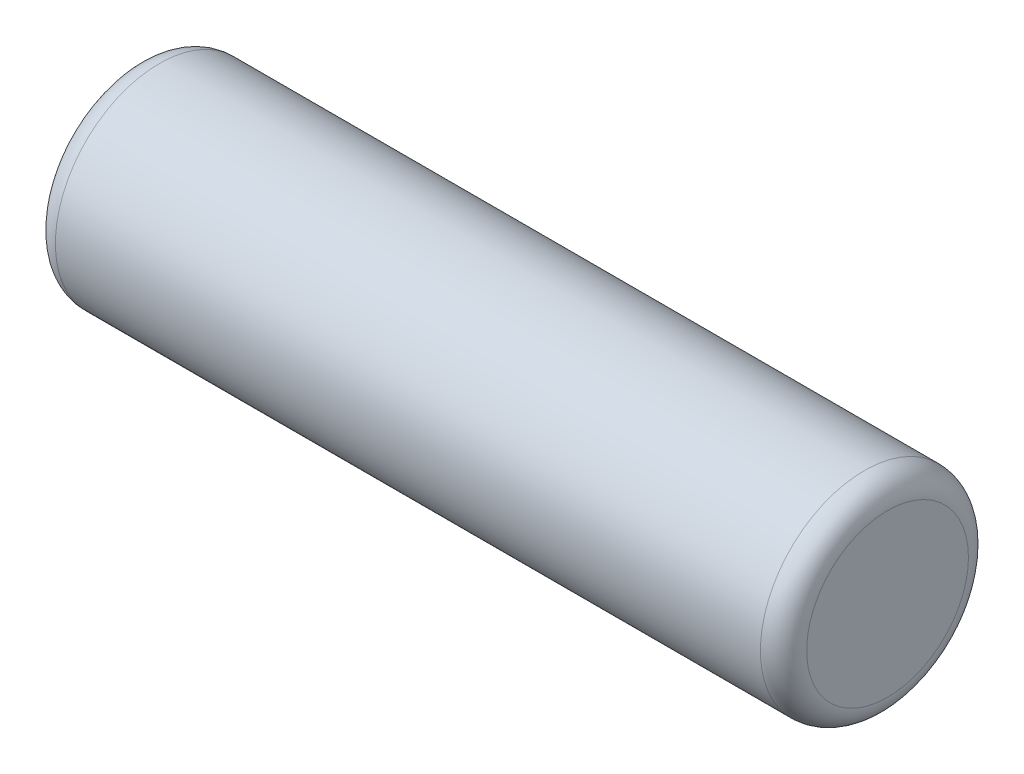
from build123d import *

# Parameters (mm, degrees)
SKETCH1_R           = 9
BOSS_EXTRUDE1_DEPTH = 65
FILLET1_R           = 2


with BuildPart() as part:
    # Sketch1 → Boss-Extrude1 (new body)
    with BuildSketch(Plane(origin=(0, 0, 0), x_dir=(0, 0, -1), z_dir=(1, 0, 0))):
        Circle(SKETCH1_R)
    extrude(amount=BOSS_EXTRUDE1_DEPTH)

    # Fillet1
    fillet1_edges = [part.edges().sort_by_distance(p)[0] for p in [
        (0, 0, 9),
        (65, 0, 9),
    ]]
    fillet(fillet1_edges, radius=FILLET1_R)


solid = part.part
